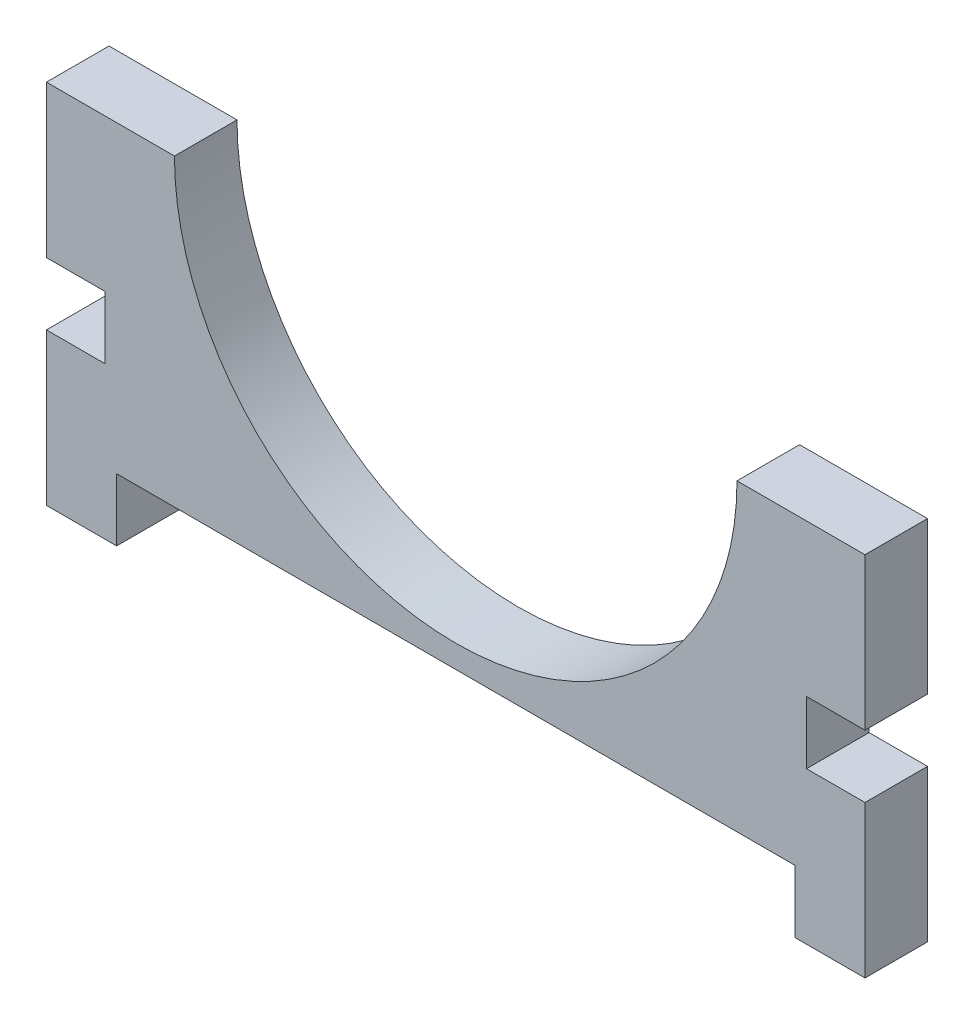
from build123d import *

# Parameters (mm, degrees)
BOSS_EXTRUDE1_DEPTH = 5.35


with BuildPart() as part:
    # Model → Boss-Extrude1 (new body)
    with BuildSketch(Plane.XY):
        with BuildLine():
            Line((-29, 0), (29, 0))
            Line((29, 0), (29, -5.35))
            Line((29, -5.35), (35, -5.35))
            Line((35, -5.35), (35, -0.784492516))
            Line((35, -0.784492516), (35, 7.65))
            Line((35, 7.65), (30, 7.65))
            Line((30, 7.65), (30, 13))
            Line((30, 13), (35, 13))
            Line((35, 13), (35, 26))
            Line((35, 26), (24.055, 26))
            ThreePointArc((24.055, 26), (0, 1.945), (-24.055, 26))
            Line((-24.055, 26), (-35, 26))
            Line((-35, 26), (-35, 13))
            Line((-35, 13), (-30, 13))
            Line((-30, 13), (-30, 7.65))
            Line((-30, 7.65), (-35, 7.65))
            Line((-35, 7.65), (-35, -0.784492516))
            Line((-35, -0.784492516), (-35, -5.35))
            Line((-35, -5.35), (-29, -5.35))
            Line((-29, -5.35), (-29, 0))
        make_face()
    extrude(amount=BOSS_EXTRUDE1_DEPTH)


solid = part.part
